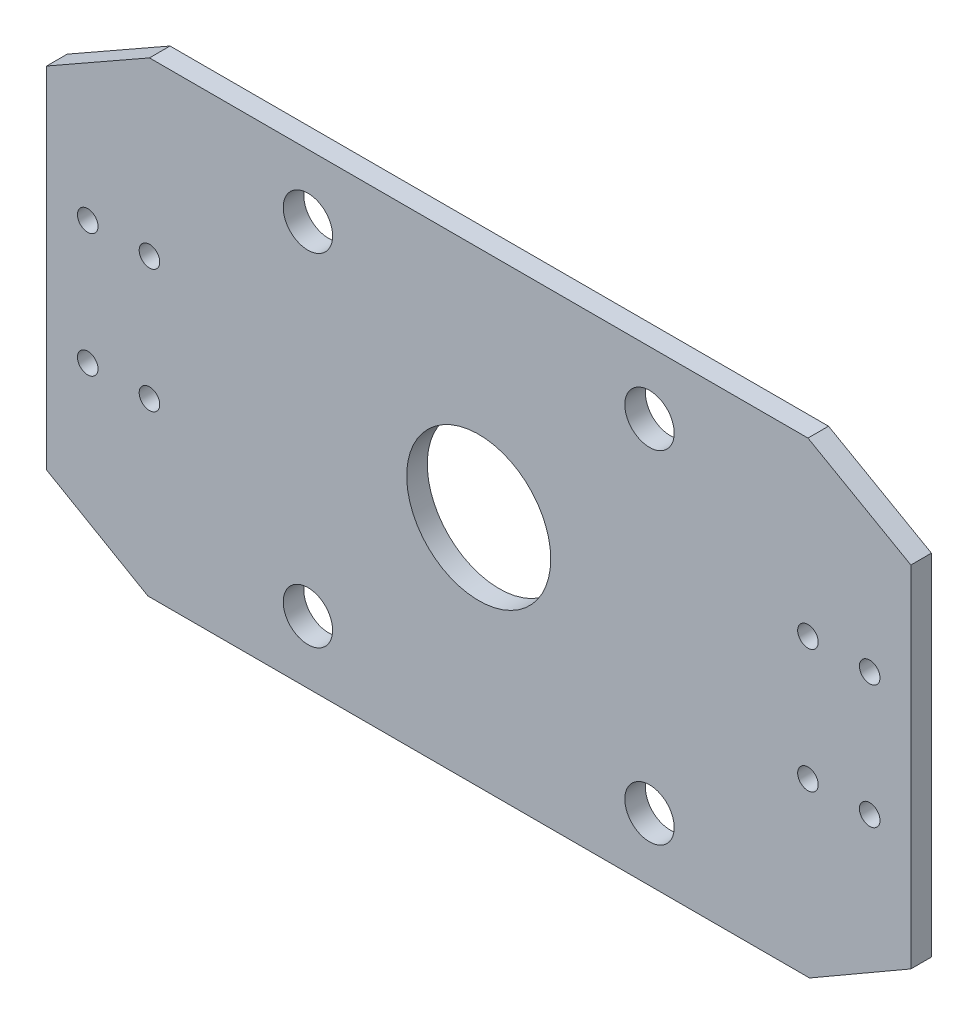
from build123d import *

# Parameters (mm, degrees)
SKETCH1_R           = 17.5
SKETCH1_R_2         = 2.5
SKETCH1_R_3         = 6
BOSS_EXTRUDE1_DEPTH = 5


with BuildPart() as part:
    # Sketch1 → Boss-Extrude1 (new body)
    with BuildSketch(Plane.XY):
        Polygon((80, 55.80696734), (-80, 55.80696734), (-105, 41.595146974), (-105, -43.404853026), (-80.384405058, -57.616673392), (80.384405058, -57.616673392), (105, -43.404853026), (105, 41.595146974), align=None)
        with Locations((0, -0.904853026)):
            Circle(SKETCH1_R, mode=Mode.SUBTRACT)
        with Locations((-95, 14.095146974)):
            Circle(SKETCH1_R_2, mode=Mode.SUBTRACT)
        with Locations((-80, 14.095146974)):
            Circle(SKETCH1_R_2, mode=Mode.SUBTRACT)
        with Locations((-95, -15.904853026)):
            Circle(SKETCH1_R_2, mode=Mode.SUBTRACT)
        with Locations((-80, -15.904853026)):
            Circle(SKETCH1_R_2, mode=Mode.SUBTRACT)
        with Locations(Location((80, -15.904853026, 0), (0, 0, 180))):
            Circle(SKETCH1_R_2, mode=Mode.SUBTRACT)
        with Locations(Location((95, -15.904853026, 0), (0, 0, 180))):
            Circle(SKETCH1_R_2, mode=Mode.SUBTRACT)
        with Locations(Location((95, 14.095146974, 0), (0, 0, 180))):
            Circle(SKETCH1_R_2, mode=Mode.SUBTRACT)
        with Locations(Location((80, 14.095146974, 0), (0, 0, 180))):
            Circle(SKETCH1_R_2, mode=Mode.SUBTRACT)
        with Locations((-41.5, 40.595146974)):
            Circle(SKETCH1_R_3, mode=Mode.SUBTRACT)
        with Locations((41.5, 40.595146974)):
            Circle(SKETCH1_R_3, mode=Mode.SUBTRACT)
        with Locations((41.5, -42.404853026)):
            Circle(SKETCH1_R_3, mode=Mode.SUBTRACT)
        with Locations((-41.5, -42.404853026)):
            Circle(SKETCH1_R_3, mode=Mode.SUBTRACT)
    extrude(amount=BOSS_EXTRUDE1_DEPTH)


solid = part.part
